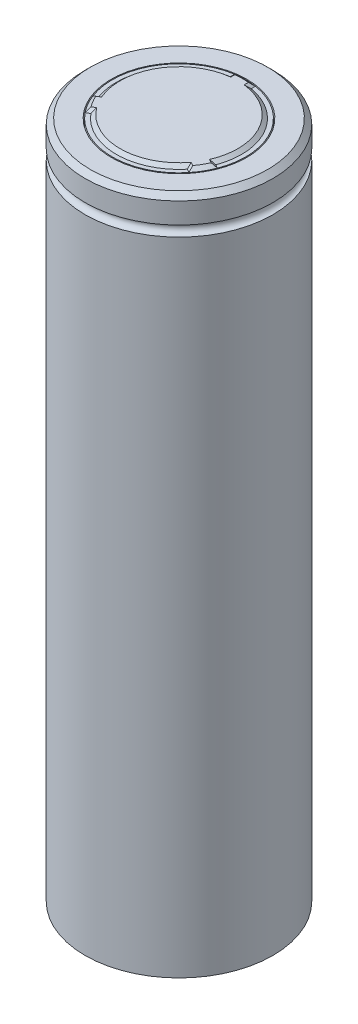
from build123d import *

# Parameters (mm, degrees)
SKETCH_1_R          = 9
EXTRUDE_1_DEPTH     = 65
SKETCH_2_R          = 0.5
CHAMFER_1_SIZE      = 0.5
SKETCH_3_R          = 6.5
SKETCH_3_R_2        = 6.4
CUT_EXTRUDE_1_DEPTH = 65
EXTRUDE_2_DEPTH     = 0.3
EXTRUDE_2_DRAFT     = 50


with BuildPart() as part:
    # Эскиз1 → Бобышка-Вытянуть1 (new body)
    with BuildSketch(Plane(origin=(0, 0, 0), x_dir=(1, 0, 0), z_dir=(0, 1, 0))):
        with Locations(Location((0, 0, 0), (0, 0, 270))):
            Circle(SKETCH_1_R)
    extrude(amount=EXTRUDE_1_DEPTH)

    # Эскиз2 → Вырез-Повернуть1 (revolve, cut)
    with BuildSketch(Plane.XY, mode=Mode.PRIVATE) as cut_revolve_1_sk:
        with Locations((-9, 62)):
            Circle(SKETCH_2_R)
    revolve(cut_revolve_1_sk.sketch.rotate(Axis((0, 0, 0), (0, 1, 0)), 270), axis=Axis((0, 0, 0), (0, 1, 0)), mode=Mode.SUBTRACT)

    # Фаска1
    chamfer_1_edges = [part.edges().sort_by_distance(p)[0] for p in [
        (0, 65, -9),
    ]]
    chamfer(chamfer_1_edges, length=CHAMFER_1_SIZE)

    # Эскиз3 → Вырез-Вытянуть1 (cut)
    with BuildSketch(Plane.XZ):
        with Locations(Location((0, 0, 0), (0, 0, 270))):
            Circle(SKETCH_3_R)
        with Locations(Location((0, 0, 0), (0, 0, 270))):
            Circle(SKETCH_3_R_2, mode=Mode.SUBTRACT)
    extrude(amount=-CUT_EXTRUDE_1_DEPTH, mode=Mode.SUBTRACT)


with BuildPart() as cut_extrude_1_piece_1:
    # of the separate pieces the step leaves, piece 1, a body of its own (cut_extrude_1_pieces)
    add(part.part.solids().sort_by_distance((0, 65, -6.4))[0])


with BuildPart() as cut_extrude_1_piece_2:
    # of the separate pieces the step leaves, piece 2, a body of its own (cut_extrude_1_pieces)
    add(part.part.solids().sort_by_distance((0, 64.5, 9))[0])


with BuildPart() as extrude_2_tool:
    # Эскиз4 → Бобышка-Вытянуть2 (with draft: the straight prism first)
    with BuildSketch(Plane(origin=(0, 65, 0), x_dir=(1, 0, 0), z_dir=(0, 1, 0))):
        with BuildLine():
            ThreePointArc((-1, 5.916079783), (-5.196152423, 3), (-5.623475383, -2.092014488))
            Line((-5.623475383, -2.092014488), (-5.974486277, -2.294670722))
            ThreePointArc((-5.974486277, -2.294670722), (-5.542562584, -3.2), (-4.974486277, -4.02672153))
            Line((-4.974486277, -4.02672153), (-4.623475383, -3.824065295))
            ThreePointArc((-4.623475383, -3.824065295), (0, -6), (4.623475383, -3.824065295))
            Line((4.623475383, -3.824065295), (4.974486277, -4.02672153))
            ThreePointArc((4.974486277, -4.02672153), (5.542562584, -3.2), (5.974486277, -2.294670722))
            Line((5.974486277, -2.294670722), (5.623475383, -2.092014488))
            ThreePointArc((5.623475383, -2.092014488), (5.196152423, 3), (1, 5.916079783))
            Line((1, 5.916079783), (1, 6.321392252))
            ThreePointArc((1, 6.321392252), (0, 6.4), (-1, 6.321392252))
            Line((-1, 6.321392252), (-1, 5.916079783))
        make_face()
    extrude(amount=EXTRUDE_2_DEPTH)
    # Бобышка-Вытянуть2: the draft: its side faces are tilted about the plane it starts from
    extrude_2_sides = [extrude_2_tool.faces().sort_by_distance(p)[0] for p in [
        (-5.196152423, 65.15, -3),
        (-5.79898083, 65.15, 2.193342605),
        (-5.542562584, 65.15, 3.2),
        (-4.79898083, 65.15, 3.925393412),
        (0, 65.15, 6),
        (4.79898083, 65.15, 3.925393412),
        (5.542562584, 65.15, 3.2),
        (5.79898083, 65.15, 2.193342605),
        (5.196152423, 65.15, -3),
        (1, 65.15, -6.118736017),
        (0, 65.15, -6.4),
        (-1, 65.15, -6.118736017),
    ]]
    draft(extrude_2_sides, Plane(origin=(0, 65, 0), x_dir=(1, 0, 0), z_dir=(0, 1, 0)), EXTRUDE_2_DRAFT)


with BuildPart() as cut_extrude_1_piece_1_1:
    add(cut_extrude_1_piece_1.part)

    # Бобышка-Вытянуть2: add extrude_2_tool
    add(extrude_2_tool.part)


solid = Compound([cut_extrude_1_piece_2.part, cut_extrude_1_piece_1_1.part])
